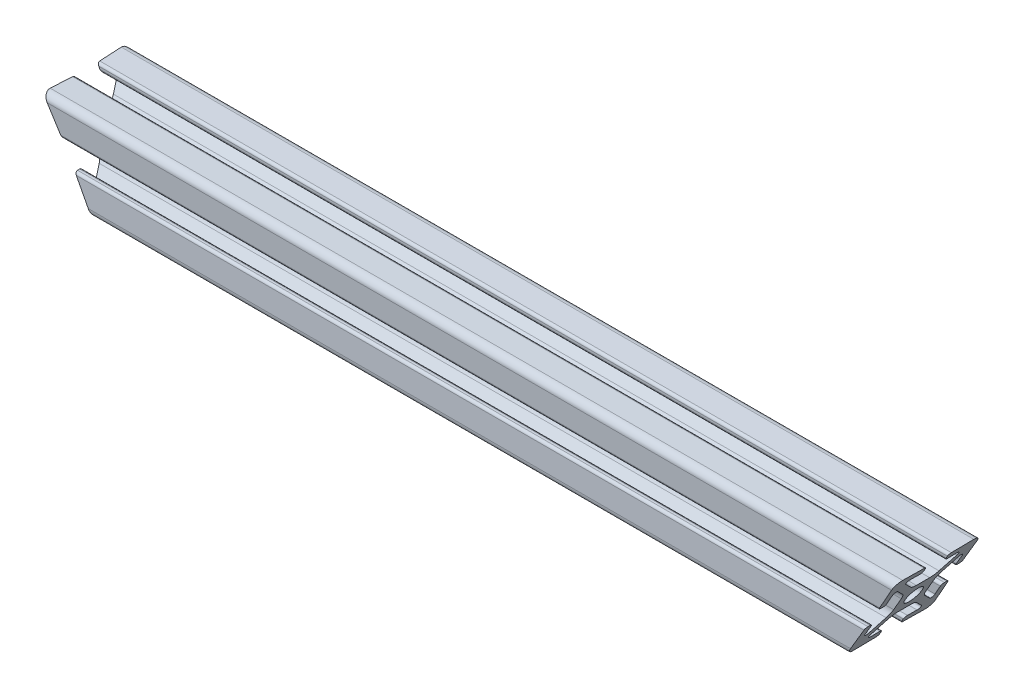
from build123d import *

# Parameters (mm, degrees)
BOSS_EXTRUDE1_DEPTH      = 127
BOSS_EXTRUDE1_DEPTH_BACK = 127
CUT_EXTRUDE1_DEPTH       = 12.7
CUT_EXTRUDE1_DEPTH_BACK  = 12.7


with BuildPart() as part:
    # Sketch3 → Boss-Extrude1 (new, two sides: drawn at the far end of the back side and taken through both)
    with BuildSketch(Plane(origin=(0, 0, 0), x_dir=(0, 0, -1), z_dir=(1, 0, 0)).offset(-BOSS_EXTRUDE1_DEPTH_BACK)):
        with BuildLine():
            Line((0, 4.826), (1.984228399, 4.826))
            ThreePointArc((1.984228399, 4.826), (3.199248297, 5.067682484), (4.229292429, 5.75593597))
            Line((4.229292429, 5.75593597), (7.586577723, 9.113221264))
            ThreePointArc((7.586577723, 9.113221264), (7.746562132, 9.955883421), (7.021168939, 10.413572441))
            Line((7.021168939, 10.413572441), (4.090593416, 10.311234489))
            ThreePointArc((4.090593416, 10.311234489), (3.534670322, 10.524633371), (3.302, 11.072770299))
            Line((3.302, 11.072770299), (3.302, 11.70815736))
            ThreePointArc((3.302, 11.70815736), (3.515863072, 12.237487038), (4.037406584, 12.46969317))
            Line((4.037406584, 12.46969317), (10.597084223, 12.698762161))
            ThreePointArc((10.597084223, 12.698762161), (12.104840979, 12.104840979), (12.698762161, 10.597084223))
            Line((12.698762161, 10.597084223), (12.46969317, 4.037406584))
            ThreePointArc((12.46969317, 4.037406584), (12.237487038, 3.515863072), (11.70815736, 3.302))
            Line((11.70815736, 3.302), (11.072770299, 3.302))
            ThreePointArc((11.072770299, 3.302), (10.524633371, 3.534670322), (10.311234489, 4.090593416))
            Line((10.311234489, 4.090593416), (10.413572441, 7.021168939))
            ThreePointArc((10.413572441, 7.021168939), (9.955883421, 7.746562132), (9.113221264, 7.586577723))
            Line((9.113221264, 7.586577723), (5.75593597, 4.229292429))
            ThreePointArc((5.75593597, 4.229292429), (5.067682484, 3.199248297), (4.826, 1.984228399))
            Line((4.826, 1.984228399), (4.826, 0))
            Line((4.826, 0), (2.54, 0))
            ThreePointArc((2.54, 0), (1.796051224, 1.796051224), (0, 2.54))
            Line((0, 2.54), (0, 4.826))
        make_face()
    extrude(amount=BOSS_EXTRUDE1_DEPTH + BOSS_EXTRUDE1_DEPTH_BACK)

    # Mirror1: part across plane


with BuildPart() as part_1:
    add(part.part)
    add(part.part.mirror(Plane.ZX))

    # Mirror2: part across plane


with BuildPart() as part_2:
    add(part_1.part)
    add(part_1.part.mirror(Plane.XY))

    # Sketch4 → Cut-Extrude1 (cut, two sides: drawn at the far end of the back side and taken through both)
    with BuildSketch(Plane.XY.offset(-CUT_EXTRUDE1_DEPTH_BACK)):
        Polygon((-129.54, -38.1), (129.54, -38.1), (129.54, 12.7), (127, 12.7), (112.335303163, -12.7), (-112.335303163, -12.7), (-127, 12.7), (-129.54, 12.7), align=None)
    extrude(amount=CUT_EXTRUDE1_DEPTH + CUT_EXTRUDE1_DEPTH_BACK, mode=Mode.SUBTRACT)


solid = part_2.part
